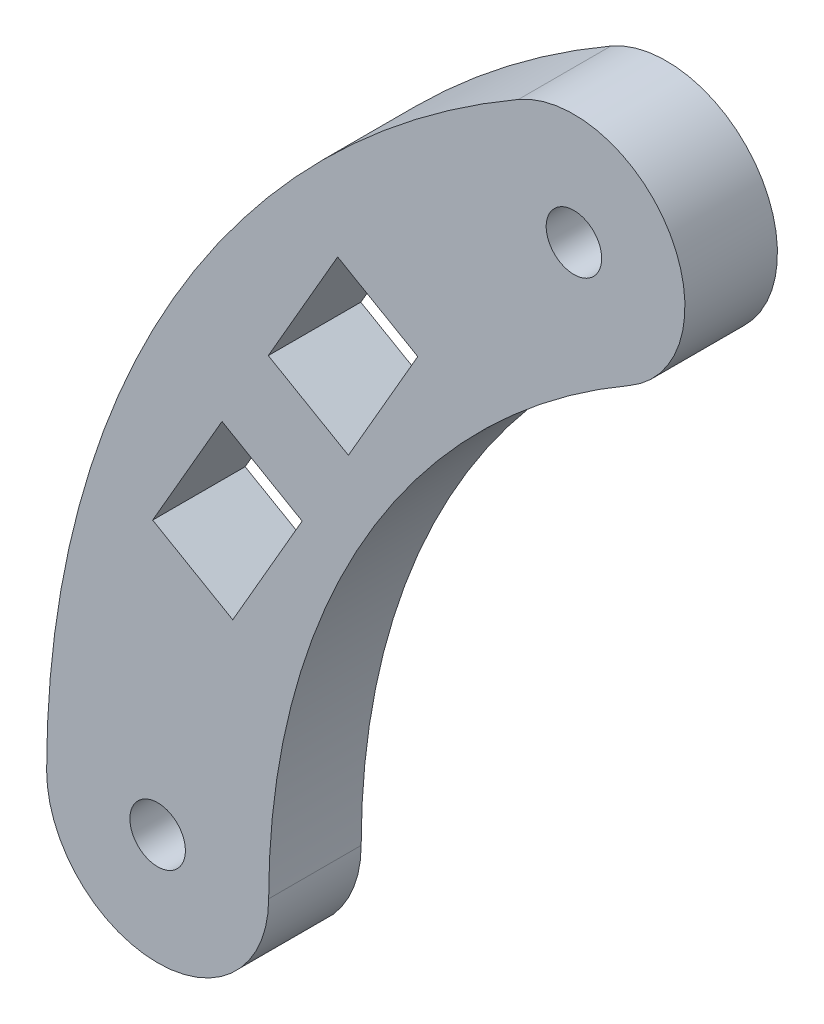
from build123d import *

# Parameters (mm, degrees)
ESQUISSE1_R        = 1.5
BOSS_EXTRU_1_DEPTH = 5


with BuildPart() as part:
    # Esquisse1 → Boss.-Extru.1 (new body)
    with BuildSketch(Plane.XY):
        with BuildLine():
            ThreePointArc((-25.5, 44.167295593), (-44.167295593, 25.5), (-51, 0))
            ThreePointArc((-51, 0), (-45, -6), (-39, 0))
            ThreePointArc((-39, 0), (-33.774990748, 19.5), (-19.5, 33.774990748))
            ThreePointArc((-19.5, 33.774990748), (-17.303847577, 41.97114317), (-25.5, 44.167295593))
        make_face()
        with Locations((-22.5, 38.97114317)):
            Circle(ESQUISSE1_R, mode=Mode.SUBTRACT)
        with Locations((-45, 0)):
            Circle(ESQUISSE1_R, mode=Mode.SUBTRACT)
        Polygon((-30.940054257, 29.410254038), (-34.690054257, 22.915063509), (-39.020181276, 25.415063509), (-35.270181276, 31.910254038), align=None, mode=Mode.SUBTRACT)
        Polygon((-45.270181276, 14.589745962), (-40.940054257, 12.089745962), (-37.190054257, 18.584936491), (-41.520181276, 21.084936491), align=None, mode=Mode.SUBTRACT)
    extrude(amount=BOSS_EXTRU_1_DEPTH)


solid = part.part
